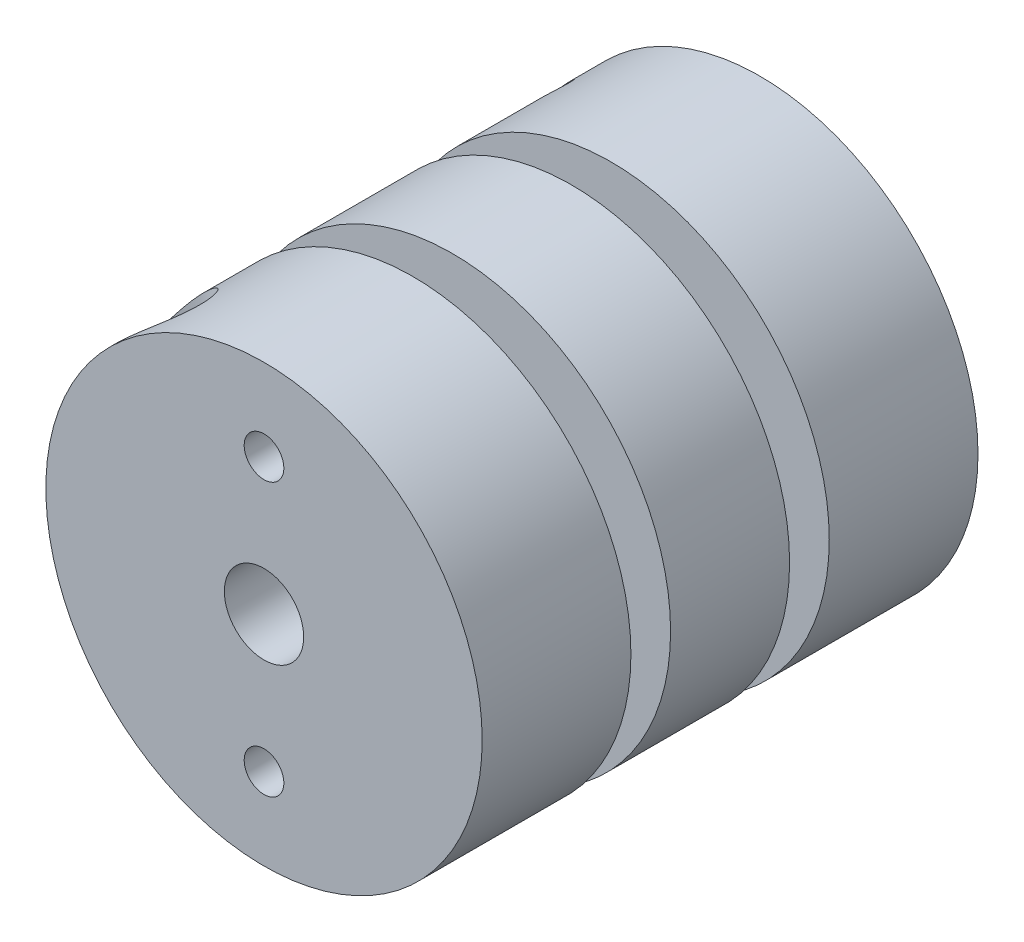
from build123d import *

# Parameters (mm, degrees)
SKETCH_1_R                   = 22
EXTRUDE_1_DEPTH              = 6
SKETCH_2_R                   = 15
EXTRUDE_2_DEPTH              = 10
EXTRUDE_START                = 15
SKETCH_3_R                   = 22
SKETCH_3_R_2                 = 2
EXTRUDE_3_DEPTH              = 15
SKETCH_4_R                   = 1.5
CUT_EXTRUDE_1_DEPTH          = 40.912404087
SKETCH_5_R                   = 4.5
CUT_EXTRUDE_2_DEPTH          = 40.91240426
HOLE_WIZARD_M4_1_D           = 3.3
HOLE_WIZARD_M4_1_CSINK_D     = 4.05
HOLE_WIZARD_M4_1_CSINK_ANGLE = 90
SKETCH_8_R                   = 1.5
CUT_EXTRUDE_3_DEPTH          = 40.91240426
SKETCH_9_R                   = 4.5
CUT_EXTRUDE_4_DEPTH          = 40.91240426
HOLE_WIZARD_M4_2_D           = 3.3
HOLE_WIZARD_M4_2_CSINK_D     = 4.05
HOLE_WIZARD_M4_2_CSINK_ANGLE = 90
SKETCH_11_R                  = 4
CUT_EXTRUDE_5_DEPTH          = 15
SKETCH_12_R                  = 5
CUT_EXTRUDE_6_DEPTH          = 15
SKETCH_13_R                  = 10
CUT_EXTRUDE_7_DEPTH          = 10


with BuildPart() as part:
    # 草图1 → 凸台-拉伸1 (new, symmetric)
    with BuildSketch(Plane.XY):
        Circle(SKETCH_1_R)
    extrude(amount=EXTRUDE_1_DEPTH, both=True)

    # 草图2 → 凸台-拉伸2 (add, symmetric)
    with BuildSketch(Plane.XY):
        Circle(SKETCH_2_R)
    extrude(amount=EXTRUDE_2_DEPTH, both=True)

    # 草图3 → 凸台-拉伸3 (add)
    with BuildSketch(Plane.XY.offset(10).offset(EXTRUDE_START)):
        Circle(SKETCH_3_R)
        with Locations(Location((0, 13.75, 0), (0, 0, 144.501487602))):
            Circle(SKETCH_3_R_2, mode=Mode.SUBTRACT)
        with Locations(Location((0, -13.75, 0), (0, 0, 180))):
            Circle(SKETCH_3_R_2, mode=Mode.SUBTRACT)
    extrude_3 = extrude(amount=-EXTRUDE_3_DEPTH)

    # 草图4 → 切除-拉伸1 (cut, through all)
    with BuildSketch(Plane(origin=(0, 0, 0), x_dir=(1, 0, 0), z_dir=(0, 1, 0))):
        with Locations(Location((-16, -20, 0), (0, 0, 270))):
            Circle(SKETCH_4_R)
    extrude(amount=-CUT_EXTRUDE_1_DEPTH, mode=Mode.SUBTRACT)

    # 草图5 → 切除-拉伸2 (cut, through all)
    with BuildSketch(Plane(origin=(0, 0, 0), x_dir=(1, 0, 0), z_dir=(0, 1, 0))):
        with Locations(Location((-16, -20, 0), (0, 0, 90))):
            Circle(SKETCH_5_R)
    extrude(amount=CUT_EXTRUDE_2_DEPTH, mode=Mode.SUBTRACT)

    # M4 螺纹孔1 (through all)
    with Locations(Plane(origin=(0, 0, 0), x_dir=(1, 0, 0), z_dir=(0, 1, 0))):
        with Locations((-16, -20)):
            CounterSinkHole(HOLE_WIZARD_M4_1_D / 2, HOLE_WIZARD_M4_1_CSINK_D / 2, counter_sink_angle=HOLE_WIZARD_M4_1_CSINK_ANGLE)

    # 镜向1: 凸台-拉伸3 across plane
    add(extrude_3.mirror(Plane.XY))

    # 草图8 → 切除-拉伸3 (cut, through all)
    with BuildSketch(Plane(origin=(0, 0, 0), x_dir=(1, 0, 0), z_dir=(0, 1, 0))):
        with Locations(Location((-16, 20, 0), (0, 0, 90))):
            Circle(SKETCH_8_R)
    extrude(amount=CUT_EXTRUDE_3_DEPTH, mode=Mode.SUBTRACT)

    # 草图9 → 切除-拉伸4 (cut, through all)
    with BuildSketch(Plane(origin=(0, 0, 0), x_dir=(1, 0, 0), z_dir=(0, 1, 0))):
        with Locations(Location((-16, 20, 0), (0, 0, 270))):
            Circle(SKETCH_9_R)
    extrude(amount=-CUT_EXTRUDE_4_DEPTH, mode=Mode.SUBTRACT)

    # M4 螺纹孔2 (through all)
    with Locations(Plane(origin=(-16, 0, -20), x_dir=(0, 0, -1), z_dir=(0, -1, 0))):
        with Locations((0, 0)):
            CounterSinkHole(HOLE_WIZARD_M4_2_D / 2, HOLE_WIZARD_M4_2_CSINK_D / 2, counter_sink_angle=HOLE_WIZARD_M4_2_CSINK_ANGLE)

    # 草图11 → 切除-拉伸5 (cut)
    with BuildSketch(Plane.XY.offset(25)):
        Circle(SKETCH_11_R)
    extrude(amount=-CUT_EXTRUDE_5_DEPTH, mode=Mode.SUBTRACT)

    # 草图12 → 切除-拉伸6 (cut)
    with BuildSketch(Plane(origin=(0, 0, -25), x_dir=(-1, 0, 0), z_dir=(0, 0, -1))):
        Circle(SKETCH_12_R)
    extrude(amount=-CUT_EXTRUDE_6_DEPTH, mode=Mode.SUBTRACT)

    # 草图13 → 切除-拉伸7 (cut, symmetric)
    with BuildSketch(Plane.XY):
        Circle(SKETCH_13_R)
    extrude(amount=CUT_EXTRUDE_7_DEPTH, both=True, mode=Mode.SUBTRACT)


solid = part.part
